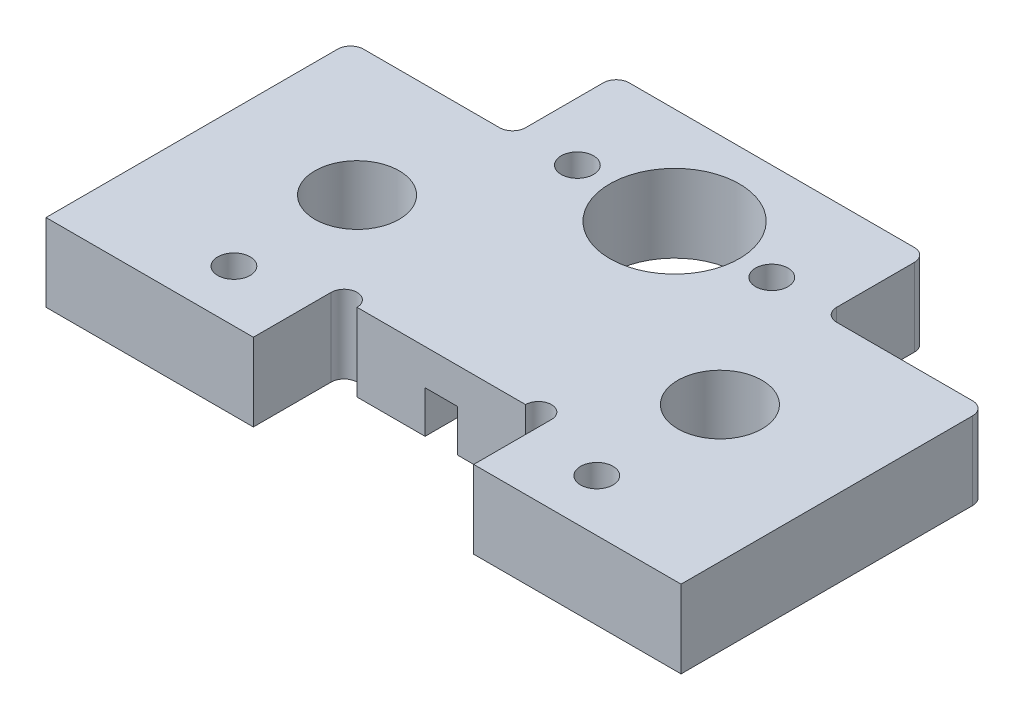
from build123d import *

# Parameters (mm, degrees)
SKETCH1_W                = 98
SKETCH1_H                = 63
BOSS_EXTRUDE1_DEPTH      = 12
CUT_EXTRUDE1_REACH       = 61.475
SKETCH2_R                = 10
SKETCH2_R_2              = 6.5
SKETCH2_R_3              = 2.5
CUT_EXTRUDE2_REACH       = 61.475
SKETCH3_W                = 34
SKETCH3_H                = 12
F_5_0_5_DIAMETER_HOLE1_D = 5
CUT_EXTRUDE3_REACH       = 61.475
SKETCH11_W               = 25
SKETCH11_H               = 16
CUT_EXTRUDE4_REACH       = 61.475
FILLET1_R                = 2
CUT_EXTRUDE7_DEPTH       = 8
CUT_EXTRUDE8_DEPTH       = 6.5


with BuildPart() as part:
    # Sketch1 → Boss-Extrude1 (new body)
    with BuildSketch(Plane(origin=(0, 0, 0), x_dir=(1, 0, 0), z_dir=(0, 1, 0))):
        Rectangle(SKETCH1_W, SKETCH1_H)
    extrude(amount=BOSS_EXTRUDE1_DEPTH)

    # Sketch2 → Cut-Extrude1 (cut, up to next)
    with BuildSketch(Plane(origin=(0, 12, 0), x_dir=(1, 0, 0), z_dir=(0, 1, 0)), mode=Mode.PRIVATE) as cut_extrude1_sk1:
        with Locations(Location((0, 16.5, 0), (0, 0, 270))):
            Circle(SKETCH2_R)
    cut_extrude1_tool1 = extrude(cut_extrude1_sk1.sketch, amount=-CUT_EXTRUDE1_REACH, mode=Mode.PRIVATE) & part.part
    # Sketch2 → Cut-Extrude1 (cut, up to next)
    with BuildSketch(Plane(origin=(0, 12, 0), x_dir=(1, 0, 0), z_dir=(0, 1, 0)), mode=Mode.PRIVATE) as cut_extrude1_sk2:
        with Locations(Location((-28, -4.5, 0), (0, 0, 270))):
            Circle(SKETCH2_R_2)
    cut_extrude1_tool2 = extrude(cut_extrude1_sk2.sketch, amount=-CUT_EXTRUDE1_REACH, mode=Mode.PRIVATE) & part.part
    # Sketch2 → Cut-Extrude1 (cut, up to next)
    with BuildSketch(Plane(origin=(0, 12, 0), x_dir=(1, 0, 0), z_dir=(0, 1, 0)), mode=Mode.PRIVATE) as cut_extrude1_sk3:
        with Locations(Location((28, -4.5, 0), (0, 0, 270))):
            Circle(SKETCH2_R_2)
    cut_extrude1_tool3 = extrude(cut_extrude1_sk3.sketch, amount=-CUT_EXTRUDE1_REACH, mode=Mode.PRIVATE) & part.part
    # Sketch2 → Cut-Extrude1 (cut, up to next)
    with BuildSketch(Plane(origin=(0, 12, 0), x_dir=(1, 0, 0), z_dir=(0, 1, 0)), mode=Mode.PRIVATE) as cut_extrude1_sk4:
        with Locations(Location((-15, 16.5, 0), (0, 0, 270))):
            Circle(SKETCH2_R_3)
    cut_extrude1_tool4 = extrude(cut_extrude1_sk4.sketch, amount=-CUT_EXTRUDE1_REACH, mode=Mode.PRIVATE) & part.part
    # Sketch2 → Cut-Extrude1 (cut, up to next)
    with BuildSketch(Plane(origin=(0, 12, 0), x_dir=(1, 0, 0), z_dir=(0, 1, 0)), mode=Mode.PRIVATE) as cut_extrude1_sk5:
        with Locations(Location((15, 16.5, 0), (0, 0, 270))):
            Circle(SKETCH2_R_3)
    cut_extrude1_tool5 = extrude(cut_extrude1_sk5.sketch, amount=-CUT_EXTRUDE1_REACH, mode=Mode.PRIVATE) & part.part
    add(cut_extrude1_tool1.solids().sort_by_distance((0, 12, -16.5))[0], mode=Mode.SUBTRACT)
    add(cut_extrude1_tool2.solids().sort_by_distance((-28, 12, 4.5))[0], mode=Mode.SUBTRACT)
    add(cut_extrude1_tool3.solids().sort_by_distance((28, 12, 4.5))[0], mode=Mode.SUBTRACT)
    add(cut_extrude1_tool4.solids().sort_by_distance((-15, 12, -16.5))[0], mode=Mode.SUBTRACT)
    add(cut_extrude1_tool5.solids().sort_by_distance((15, 12, -16.5))[0], mode=Mode.SUBTRACT)

    # Sketch3 → Cut-Extrude2 (cut, up to next)
    with BuildSketch(Plane(origin=(0, 12, 0), x_dir=(1, 0, 0), z_dir=(0, 1, 0)), mode=Mode.PRIVATE) as cut_extrude2_sk1:
        with Locations((0, -25.5)):
            Rectangle(SKETCH3_W, SKETCH3_H)
    cut_extrude2_tool1 = extrude(cut_extrude2_sk1.sketch, amount=-CUT_EXTRUDE2_REACH, mode=Mode.PRIVATE) & part.part
    add(cut_extrude2_tool1.solids().sort_by_distance((0, 12, 25.5))[0], mode=Mode.SUBTRACT)

    # Ø5.0 (5) Diameter Hole1 (through all)
    with Locations(Plane(origin=(0, 12, 0), x_dir=(-1, 0, 0), z_dir=(0, 1, 0))):
        with Locations((28, 23.5), (-28, 23.5)):
            Hole(F_5_0_5_DIAMETER_HOLE1_D / 2)

    # Sketch11 → Cut-Extrude3 (cut, up to next)
    with BuildSketch(Plane(origin=(0, 12, 0), x_dir=(-1, 0, 0), z_dir=(0, 1, 0)), mode=Mode.PRIVATE) as cut_extrude3_sk1:
        with Locations((36.5, -23.5)):
            Rectangle(SKETCH11_W, SKETCH11_H)
    cut_extrude3_tool1 = extrude(cut_extrude3_sk1.sketch, amount=-CUT_EXTRUDE3_REACH, mode=Mode.PRIVATE) & part.part
    cut_extrude3 = cut_extrude3_tool1.solids().sort_by_distance((-36.5, 12, -23.5))[0]
    add(cut_extrude3, mode=Mode.SUBTRACT)

    # Mirror1: Cut-Extrude3 across plane
    add(cut_extrude3.mirror(Plane(origin=(0, 0, 0), x_dir=(0, 0, 1), z_dir=(1, 0, 0))), mode=Mode.SUBTRACT)

    # Sketch12 → Cut-Extrude4 (cut, up to next)
    with BuildSketch(Plane(origin=(0, 12, 0), x_dir=(1, 0, 0), z_dir=(0, 1, 0)), mode=Mode.PRIVATE) as cut_extrude4_sk1:
        with BuildLine():
            Line((-17, -19.5), (-13, -19.5))
            ThreePointArc((-13, -19.5), (-15, -17.5), (-17, -19.5))
        make_face()
    cut_extrude4_tool1 = extrude(cut_extrude4_sk1.sketch, amount=-CUT_EXTRUDE4_REACH, mode=Mode.PRIVATE) & part.part
    # Sketch12 → Cut-Extrude4 (cut, up to next)
    with BuildSketch(Plane(origin=(0, 12, 0), x_dir=(1, 0, 0), z_dir=(0, 1, 0)), mode=Mode.PRIVATE) as cut_extrude4_sk2:
        with BuildLine():
            Line((13, -19.5), (17, -19.5))
            ThreePointArc((17, -19.5), (15, -17.5), (13, -19.5))
        make_face()
    cut_extrude4_tool2 = extrude(cut_extrude4_sk2.sketch, amount=-CUT_EXTRUDE4_REACH, mode=Mode.PRIVATE) & part.part
    add(cut_extrude4_tool1.solids().sort_by_distance((-15, 12, 18.651174))[0], mode=Mode.SUBTRACT)
    add(cut_extrude4_tool2.solids().sort_by_distance((15, 12, 18.651174))[0], mode=Mode.SUBTRACT)

    # Fillet1
    fillet1_edges = [part.edges().sort_by_distance(p)[0] for p in [
        (-49, 6, -15.5),
        (-24, 6, -31.5),
        (-24, 6, -15.5),
        (49, 6, -15.5),
        (24, 6, -15.5),
        (24, 6, -31.5),
    ]]
    fillet(fillet1_edges, radius=FILLET1_R)

    # Sketch18 → Cut-Extrude7 (cut)
    with BuildSketch(Plane(origin=(-30.447133355, 0, 87.682451642), x_dir=(1, 0, 0), z_dir=(0, -1, 0))):
        with BuildLine():
            Line((26.447133355, -78.182451642), (34.447133355, -78.182451642))
            ThreePointArc((34.447133355, -78.182451642), (36.447133355, -80.182451642), (34.447133355, -82.182451642))
            Line((34.447133355, -82.182451642), (26.447133355, -82.182451642))
            ThreePointArc((26.447133355, -82.182451642), (24.447133355, -80.182451642), (26.447133355, -78.182451642))
        make_face()
    extrude(amount=-CUT_EXTRUDE7_DEPTH, mode=Mode.SUBTRACT)

    # Sketch20 → Cut-Extrude8 (cut)
    with BuildSketch(Plane(origin=(-30.447133355, 0, 87.682451642), x_dir=(1, 0, 0), z_dir=(0, -1, 0))):
        with BuildLine():
            Line((32.947133355, -47.95431377), (32.947133355, -85.182451642))
            ThreePointArc((32.947133355, -85.182451642), (30.447133355, -87.682451642), (27.947133355, -85.182451642))
            Line((27.947133355, -85.182451642), (27.947133355, -47.95431377))
            ThreePointArc((27.947133355, -47.95431377), (30.447133355, -45.45431377), (32.947133355, -47.95431377))
        make_face()
    extrude(amount=-CUT_EXTRUDE8_DEPTH, mode=Mode.SUBTRACT)


solid = part.part
